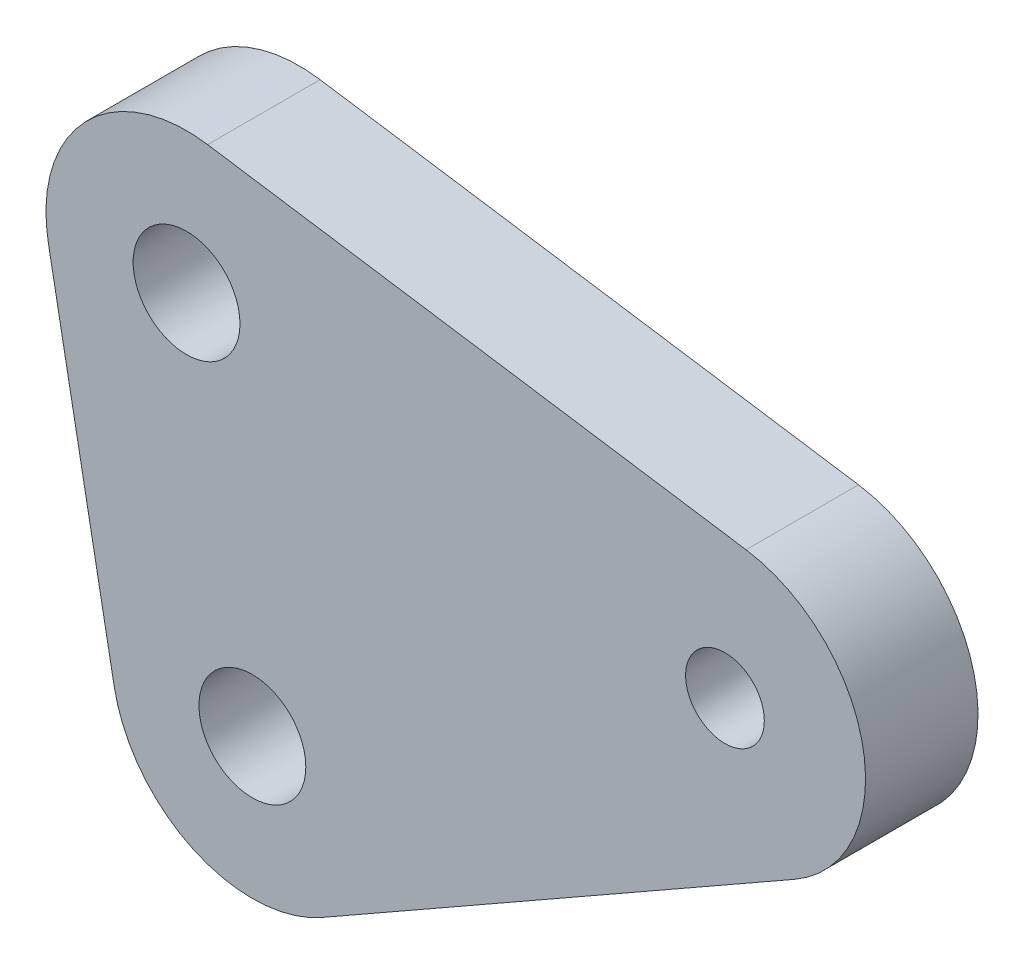
from build123d import *

# Parameters (mm, degrees)
SKETCH1_R           = 1.9
SKETCH1_R_2         = 1.4
BOSS_EXTRUDE1_DEPTH = 4


with BuildPart() as part:
    # Sketch1 → Boss-Extrude1 (new body)
    with BuildSketch(Plane.XY):
        with BuildLine():
            Line((26.891590001, 77.042584155), (46.037988185, 74.138222759))
            ThreePointArc((46.037988185, 74.138222759), (50.20397723, 70.108121575), (47.763588686, 64.850585648))
            Line((47.763588686, 64.850585648), (30.958043521, 55.274150009))
            ThreePointArc((30.958043521, 55.274150009), (26.381296021, 55.081304051), (23.568249259, 58.696629092))
            Line((23.568249259, 58.696629092), (21.227396241, 71.177426126))
            ThreePointArc((21.227396241, 71.177426126), (22.54509271, 75.572516008), (26.891590001, 77.042584155))
        make_face()
        with Locations((26.141706988, 72.099136424)):
            Circle(SKETCH1_R, mode=Mode.SUBTRACT)
        with Locations((28.482560007, 59.618339389)):
            Circle(SKETCH1_R, mode=Mode.SUBTRACT)
        with Locations((45.288105172, 69.194775028)):
            Circle(SKETCH1_R_2, mode=Mode.SUBTRACT)
    extrude(amount=BOSS_EXTRUDE1_DEPTH)


solid = part.part
